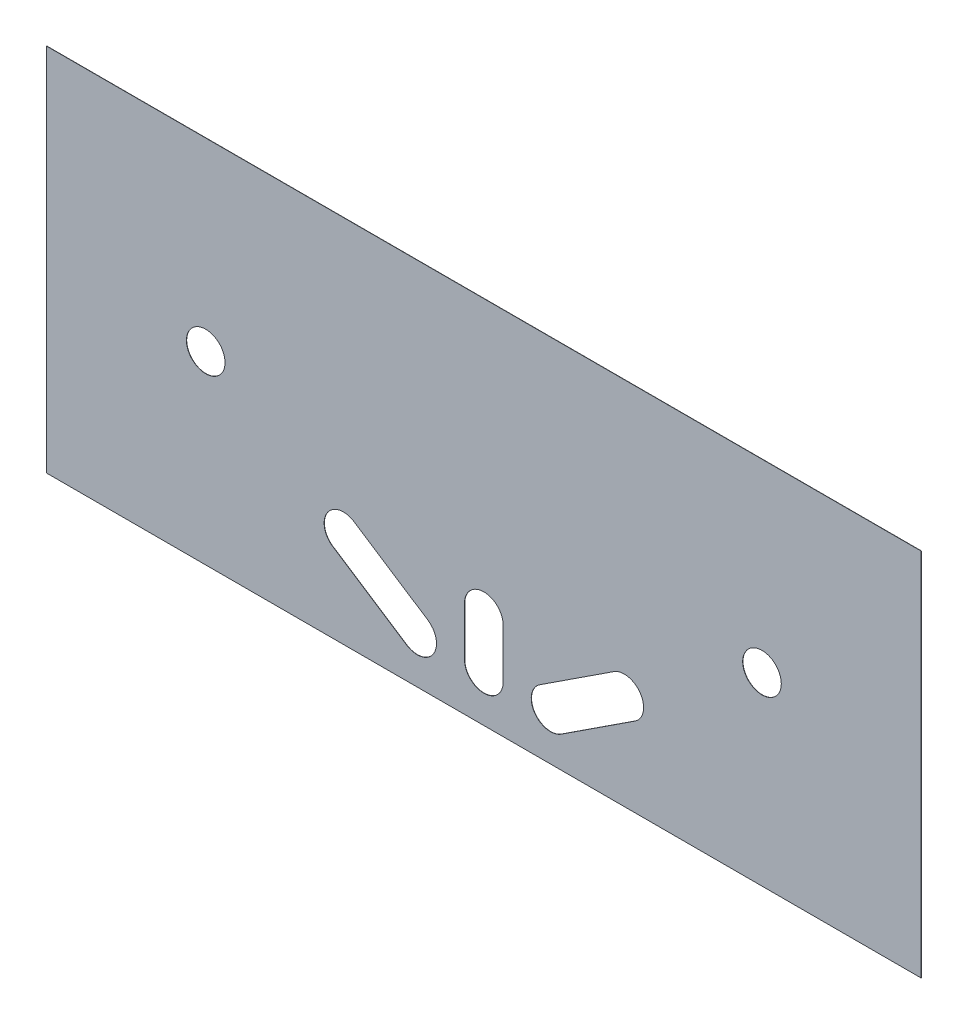
from build123d import *

# Parameters (mm, degrees)
SKETCH1_W               = 34
SKETCH1_H               = 14.37622091
BOSS_EXTRUDE1_DEPTH     = 0.01
CUT_EXTRUDE1_DEPTH      = 19.457221674
CUT_EXTRUDE1_DEPTH_BACK = 19.457221674
SKETCH2_R               = 0.75


with BuildPart() as part:
    # Sketch1 → Boss-Extrude1 (new body)
    with BuildSketch(Plane.XY):
        Rectangle(SKETCH1_W, SKETCH1_H)
    extrude(amount=BOSS_EXTRUDE1_DEPTH)

    # Sketch2 → Cut-Extrude1 (cut, two sides: drawn at the far end of the back side and taken through both)
    with BuildSketch(Plane.XY.offset(0.01).offset(-CUT_EXTRUDE1_DEPTH_BACK)):
        with Locations((10.813459435, 0)):
            Circle(SKETCH2_R)
        with Locations((-10.813459435, 0)):
            Circle(SKETCH2_R)
        with BuildLine():
            Line((5.870318791, -4.1029045), (3.001645254, -5.9778045))
            ThreePointArc((3.001645254, -5.9778045), (1.963521963, -5.760318791), (2.181007672, -4.7221955))
            Line((2.181007672, -4.7221955), (5.049681209, -2.8472955))
            ThreePointArc((5.049681209, -2.8472955), (6.0878045, -3.064781209), (5.870318791, -4.1029045))
        make_face()
        with BuildLine():
            Line((-5.870318791, -4.1029045), (-3.001645254, -5.9778045))
            ThreePointArc((-3.001645254, -5.9778045), (-1.963521963, -5.760318791), (-2.181007672, -4.7221955))
            Line((-2.181007672, -4.7221955), (-5.049681209, -2.8472955))
            ThreePointArc((-5.049681209, -2.8472955), (-6.0878045, -3.064781209), (-5.870318791, -4.1029045))
        make_face()
        with BuildLine():
            Line((-0.75, -5.35), (-0.75, -3.43605))
            ThreePointArc((-0.75, -3.43605), (0, -2.68605), (0.75, -3.43605))
            Line((0.75, -3.43605), (0.75, -5.35))
            ThreePointArc((0.75, -5.35), (0, -6.1), (-0.75, -5.35))
        make_face()
    extrude(amount=CUT_EXTRUDE1_DEPTH + CUT_EXTRUDE1_DEPTH_BACK, mode=Mode.SUBTRACT)


solid = part.part
